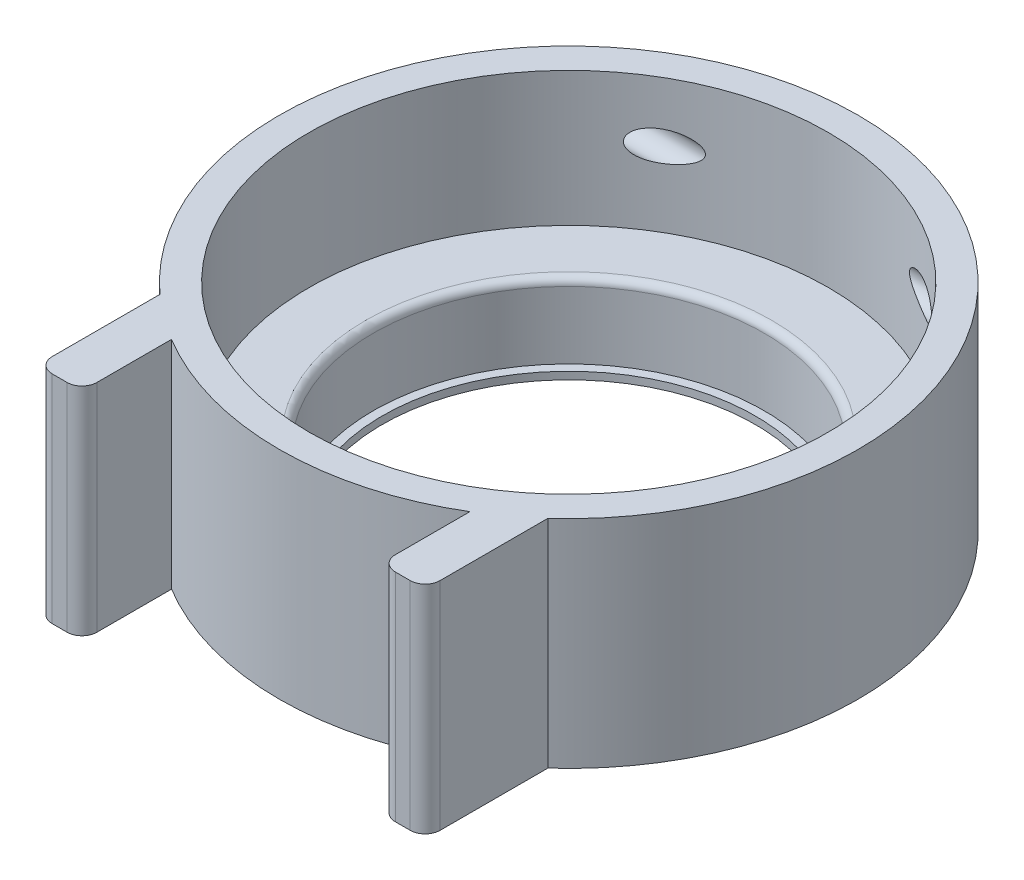
from build123d import *

# Parameters (mm, degrees)
SKETCH_1_R               = 19.4
SKETCH_1_R_2             = 17.4
EXTRUDE_1_DEPTH          = 14.5
SKETCH_2_R               = 17.5
SKETCH_2_R_2             = 13.1
EXTRUDE_1_2_DEPTH        = 5.5
SKETCH_3_R               = 13.1
SKETCH_3_R_2             = 12.5
EXTRUDE_2_DEPTH          = 0.5
EXTRUDE_3_DEPTH          = 14.5
CUT_EXTRUDE_1_DEPTH      = 34.143007514
CUT_EXTRUDE_1_DEPTH_BACK = 34.143007514
SKETCH_6_R               = 1
FILLET_1_R               = 1
FILLET_2_R               = 0.5


with BuildPart() as part:
    # 草图1 → Extrude 1 (new body)
    with BuildSketch(Plane(origin=(0, 0, 0), x_dir=(1, 0, 0), z_dir=(0, 1, 0))):
        Circle(SKETCH_1_R)
        Circle(SKETCH_1_R_2, mode=Mode.SUBTRACT)
    extrude(amount=EXTRUDE_1_DEPTH)

    # 草图2 → Extrude 1 2 (add)
    with BuildSketch(Plane(origin=(0, 0, 0), x_dir=(1, 0, 0), z_dir=(0, 1, 0))):
        Circle(SKETCH_2_R)
        with Locations(Location((0, 0, 0), (0, 0, 270))):
            Circle(SKETCH_2_R_2, mode=Mode.SUBTRACT)
    extrude(amount=EXTRUDE_1_2_DEPTH)

    # 草图3 → 凸台-拉伸2 (add)
    with BuildSketch(Plane(origin=(0, 0, 0), x_dir=(1, 0, 0), z_dir=(0, 1, 0))):
        with Locations(Location((0, 0, 0), (0, 0, 270))):
            Circle(SKETCH_3_R)
        with Locations(Location((0, 0, 0), (0, 0, 270))):
            Circle(SKETCH_3_R_2, mode=Mode.SUBTRACT)
    extrude(amount=EXTRUDE_2_DEPTH)

    # 草图4 → 凸台-拉伸3 (add)
    with BuildSketch(Plane(origin=(0, 0, 0), x_dir=(1, 0, 0), z_dir=(0, 1, 0))):
        with BuildLine():
            ThreePointArc((-10, -16.624078922), (-11.553641494, -15.584395023), (-13, -14.4))
            Line((-13, -14.4), (-13, -22.624078922))
            Line((-13, -22.624078922), (-10, -22.624078922))
            Line((-10, -22.624078922), (-10, -16.624078922))
        make_face()
        with BuildLine():
            Line((13, -22.624078922), (13, -14.4))
            ThreePointArc((13, -14.4), (11.553641494, -15.584395023), (10, -16.624078922))
            Line((10, -16.624078922), (10, -22.624078922))
            Line((10, -22.624078922), (13, -22.624078922))
        make_face()
    extrude(amount=EXTRUDE_3_DEPTH)

    # 草图6 → 切除-拉伸1 (cut, two sides: drawn at the far end of the back side and taken through both)
    with BuildSketch(Plane(origin=(0, 0, 0), x_dir=(0, 0, -1), z_dir=(1, 0, 0)).offset(-CUT_EXTRUDE_1_DEPTH_BACK)):
        with Locations((15, 10.5)):
            Circle(SKETCH_6_R)
    extrude(amount=CUT_EXTRUDE_1_DEPTH + CUT_EXTRUDE_1_DEPTH_BACK, mode=Mode.SUBTRACT)

    # 圆角1
    fillet_1_edges = [part.edges().sort_by_distance(p)[0] for p in [
        (-13, 7.25, 22.624078922),
        (-10, 7.25, 22.624078922),
        (13, 7.25, 22.624078922),
        (10, 7.25, 22.624078922),
    ]]
    fillet(fillet_1_edges, radius=FILLET_1_R)

    # 圆角2
    fillet_2_edges = [part.edges().sort_by_distance(p)[0] for p in [
        (0, 5.5, -13.1),
    ]]
    fillet(fillet_2_edges, radius=FILLET_2_R)


solid = part.part
